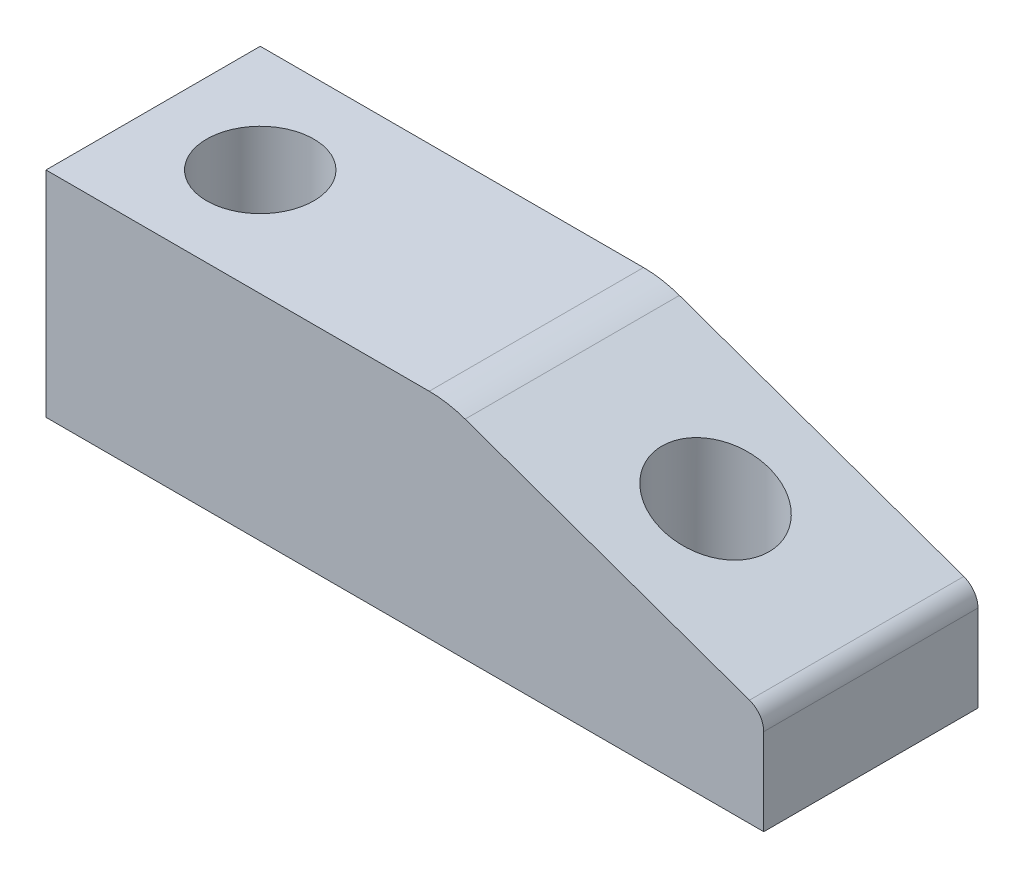
from build123d import *

# Parameters (mm, degrees)
BOSS_EXTRUDE1_DEPTH      = 20
BOSS_EXTRUDE1_DEPTH_BACK = 20
SKETCH1_W                = 134
SKETCH1_H                = 40
CUT_EXTRUDE1_DEPTH       = 40
FILLET1_R                = 20
FILLET2_R                = 4
SKETCH3_R                = 10
CUT_EXTRUDE2_DEPTH       = 29
SKETCH4_R                = 6
CUT_EXTRUDE3_DEPTH       = 11


with BuildPart() as part:
    # Sketch1 → Boss-Extrude1 (new, two sides: drawn at the far end of the back side and taken through both)
    with BuildSketch(Plane.XY.offset(-BOSS_EXTRUDE1_DEPTH_BACK)):
        Rectangle(SKETCH1_W, SKETCH1_H)
    extrude(amount=BOSS_EXTRUDE1_DEPTH + BOSS_EXTRUDE1_DEPTH_BACK)

    # Sketch2 → Cut-Extrude1 (cut)
    with BuildSketch(Plane.XY.offset(20)):
        Polygon((8, 20), (67, -1), (67, 20), align=None)
    extrude(amount=-CUT_EXTRUDE1_DEPTH, mode=Mode.SUBTRACT)

    # Fillet1
    fillet1_edges = [part.edges().sort_by_distance(p)[0] for p in [
        (8, 20, 0),
    ]]
    fillet(fillet1_edges, radius=FILLET1_R)

    # Fillet2
    fillet2_edges = [part.edges().sort_by_distance(p)[0] for p in [
        (67, -1, 0),
    ]]
    fillet(fillet2_edges, radius=FILLET2_R)

    # Sketch3 → Cut-Extrude2 (cut)
    with BuildSketch(Plane(origin=(0, 20, 0), x_dir=(1, 0, 0), z_dir=(0, 1, 0))):
        with Locations(Location((-47, 0, 0), (0, 0, 270))):
            Circle(SKETCH3_R)
        with Locations(Location((38, 0, 0), (0, 0, 270))):
            Circle(SKETCH3_R)
    extrude(amount=-CUT_EXTRUDE2_DEPTH, mode=Mode.SUBTRACT)

    # Sketch4 → Cut-Extrude3 (cut)
    with BuildSketch(Plane(origin=(0, -9, 0), x_dir=(1, 0, 0), z_dir=(0, 1, 0))):
        with Locations(Location((-47, 0, 0), (0, 0, 270))):
            Circle(SKETCH4_R)
        with Locations(Location((38, 0, 0), (0, 0, 270))):
            Circle(SKETCH4_R)
    extrude(amount=-CUT_EXTRUDE3_DEPTH, mode=Mode.SUBTRACT)


solid = part.part
